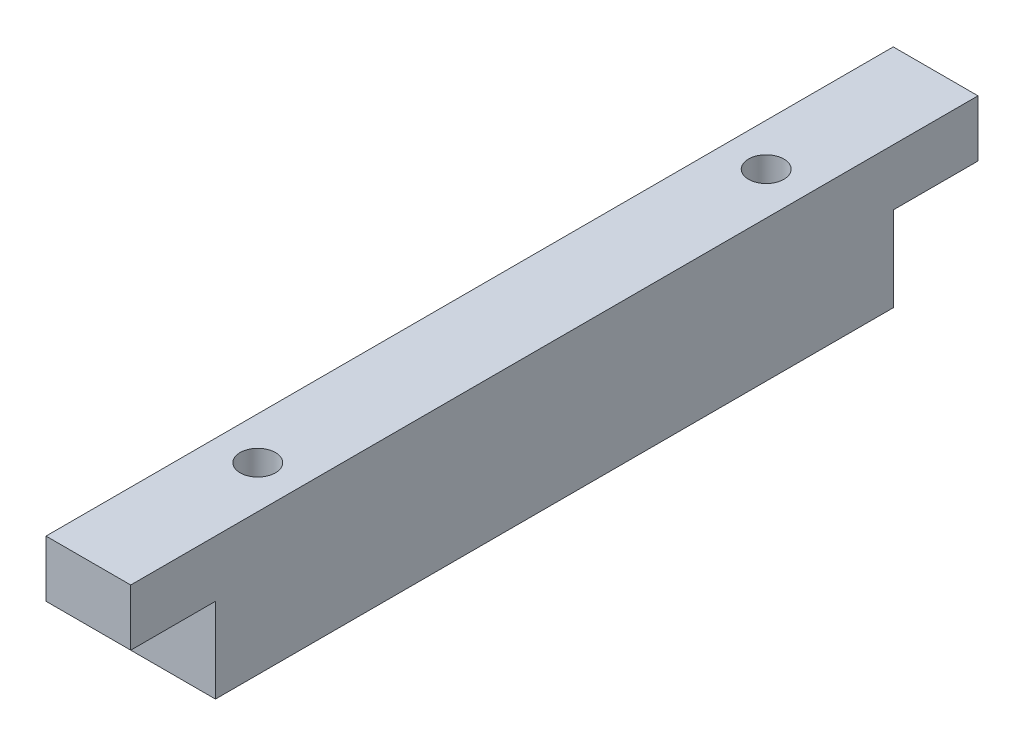
from build123d import *

# Parameters (mm, degrees)
BOSS_EXTRUDE1_DEPTH         = 6
TAP_DRILL_FOR_M3X0_5_TAP1_D = 2.5


with BuildPart() as part:
    # Sketch1 → Boss-Extrude1 (new body)
    with BuildSketch(Plane(origin=(0, 0, 0), x_dir=(0, 0, -1), z_dir=(1, 0, 0))):
        Polygon((0, 6), (0, 10), (60, 10), (60, 6), (54, 6), (54, 0), (6, 0), (6, 6), align=None)
    extrude(amount=BOSS_EXTRUDE1_DEPTH)

    # Tap Drill for M3x0.5 Tap1 (through all)
    with Locations(Plane(origin=(0, 0, 0), x_dir=(-1, 0, 0), z_dir=(0, -1, 0))):
        with Locations((-3, 12), (-3, 48)):
            Hole(TAP_DRILL_FOR_M3X0_5_TAP1_D / 2)


solid = part.part
